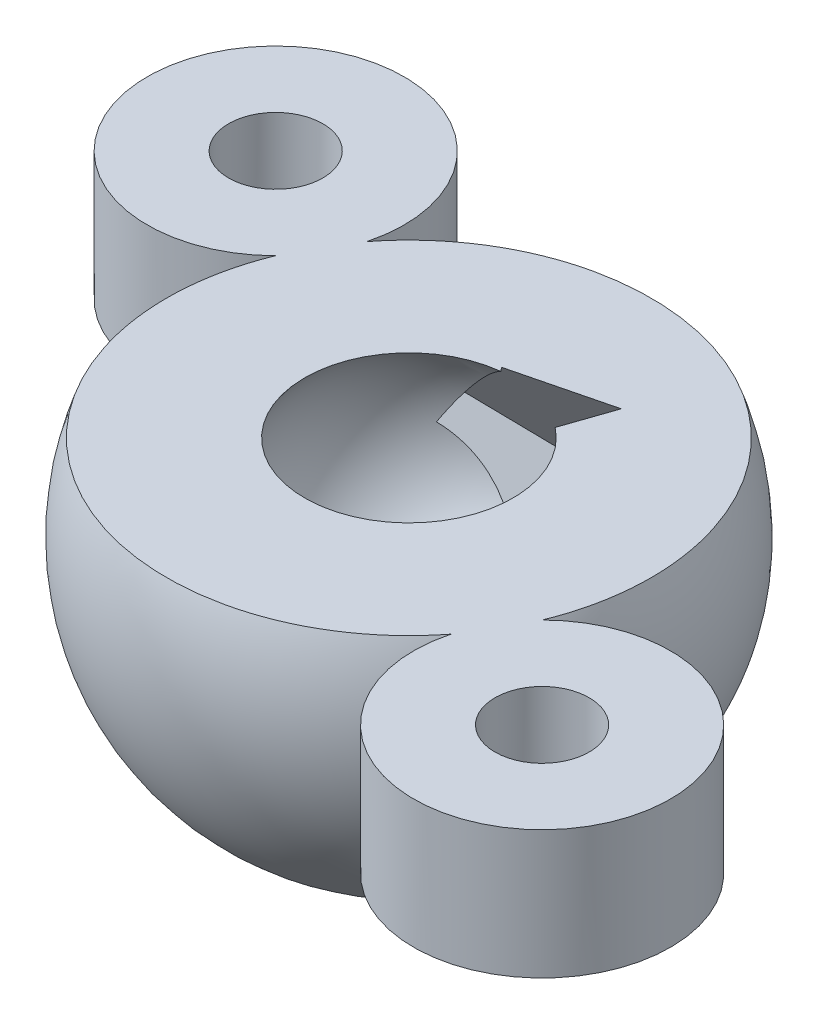
from build123d import *

# Parameters (mm, degrees)
DOME_TRIM_SKETCH_W           = 13.999999999999993
DOME_TRIM_SKETCH_H           = 5.000000000000014
DOME_TRIM_DEPTH              = 14
RETAINER_FEATURE_3_PROFILE_R = 3.0000000000000027
RETAINER_FEATURE_3_DEPTH     = 3
RETAINER_FEATURE_4_PROFILE_R = 3.0000000000000027
RETAINER_FEATURE_4_DEPTH     = 3
RETAINER_FEATURE_6_PROFILE_R = 1.1000000000000036
RETAINER_FEATURE_6_DEPTH     = 4.25
RETAINER_FEATURE_7_PROFILE_R = 2.1000000000000045
RETAINER_FEATURE_7_DEPTH     = 1.45
RETAINER_FEATURE_8_PROFILE_R = 1.1000000000000036
RETAINER_FEATURE_8_DEPTH     = 4.25
RETAINER_FEATURE_9_PROFILE_R = 2.1000000000000045
RETAINER_FEATURE_9_DEPTH     = 1.45
RETAINER_FEATURE_12_DEPTH    = 10


with BuildPart() as part:
    # Retainer Dome Sketch → Retainer Dome (revolve)
    with BuildSketch(Plane(origin=(0, -73, 0), x_dir=(-1, 0, 0), z_dir=(0, -1, 0))):
        with BuildLine():
            Line((76.48780366869515, -22.98076211353316), (66.09549882328189, -28.980762113533164))
            ThreePointArc((66.09549882328189, -28.980762113533164), (74.29165124598852, -31.176914536239792), (76.48780366869515, -22.98076211353316))
        make_face()
    revolve(axis=Axis((-62.63139720814413, -73, 30.98076211353316), (-0.8660254037844387, 0, -0.49999999999999994)))

    # Dome Trim Sketch → Dome Trim (cut)
    with BuildSketch(Plane(origin=(-36.156560608000376, 0, -20.874999999999996), x_dir=(-0.49999999999999944, 0, 0.866025403784439), z_dir=(-0.866025403784439, 0, -0.49999999999999944))):
        with Locations((58.145825622994224, -68.5)):
            Rectangle(DOME_TRIM_SKETCH_W, DOME_TRIM_SKETCH_H)
    extrude(amount=DOME_TRIM_DEPTH, mode=Mode.SUBTRACT)

    # Retainer Feature 3 profile → Retainer Feature 3 (add)
    with BuildSketch(Plane(origin=(0, -71.00000000000001, 0), x_dir=(-1, 0, 0), z_dir=(0, -1, 0))):
        with Locations((63.93043531382078, -30.23076211353316)):
            Circle(RETAINER_FEATURE_3_PROFILE_R)
    extrude(amount=RETAINER_FEATURE_3_DEPTH)

    # Retainer Feature 4 profile → Retainer Feature 4 (add)
    with BuildSketch(Plane(origin=(0, -71.00000000000001, 0), x_dir=(-1, 0, 0), z_dir=(0, -1, 0))):
        with Locations((78.65286717815624, -21.73076211353316)):
            Circle(RETAINER_FEATURE_4_PROFILE_R)
    extrude(amount=RETAINER_FEATURE_4_DEPTH)

    # Spherical Seat Sketch → Spherical Seat (revolve, cut)
    with BuildSketch(Plane(origin=(0, -73, 0), x_dir=(-1, 0, 0), z_dir=(0, -1, 0))):
        with BuildLine():
            Line((74.0196312679095, -24.405762113533164), (68.56367122406753, -27.55576211353316))
            ThreePointArc((68.56367122406753, -27.55576211353316), (72.86665124598852, -28.708742135454145), (74.0196312679095, -24.405762113533164))
        make_face()
    revolve(axis=Axis((-62.63139720814413, -73, 30.98076211353316), (-0.8660254037844387, 0, -0.49999999999999994)), mode=Mode.SUBTRACT)

    # Retainer Feature 6 profile → Retainer Feature 6 (cut)
    with BuildSketch(Plane(origin=(0, -70, 0), x_dir=(-1, 0, 0), z_dir=(0, -1, 0))):
        with Locations(Location((63.93043531382078, -30.23076211353316, 0), (0, 0, 270))):
            Circle(RETAINER_FEATURE_6_PROFILE_R)
    extrude(amount=RETAINER_FEATURE_6_DEPTH, mode=Mode.SUBTRACT)

    # Retainer Feature 7 profile → Retainer Feature 7 (cut)
    with BuildSketch(Plane(origin=(0, -72.8, 0), x_dir=(-1, 0, 0), z_dir=(0, -1, 0))):
        with Locations(Location((63.93043531382078, -30.23076211353316, 0), (0, 0, 90))):
            Circle(RETAINER_FEATURE_7_PROFILE_R)
    extrude(amount=RETAINER_FEATURE_7_DEPTH, mode=Mode.SUBTRACT)

    # Retainer Feature 8 profile → Retainer Feature 8 (cut)
    with BuildSketch(Plane(origin=(0, -70, 0), x_dir=(-1, 0, 0), z_dir=(0, -1, 0))):
        with Locations(Location((78.65286717815624, -21.73076211353316, 0), (0, 0, 270))):
            Circle(RETAINER_FEATURE_8_PROFILE_R)
    extrude(amount=RETAINER_FEATURE_8_DEPTH, mode=Mode.SUBTRACT)

    # Retainer Feature 9 profile → Retainer Feature 9 (cut)
    with BuildSketch(Plane(origin=(0, -72.8, 0), x_dir=(-1, 0, 0), z_dir=(0, -1, 0))):
        with Locations(Location((78.65286717815624, -21.73076211353316, 0), (0, 0, 90))):
            Circle(RETAINER_FEATURE_9_PROFILE_R)
    extrude(amount=RETAINER_FEATURE_9_DEPTH, mode=Mode.SUBTRACT)

    # Middle Right Fixed Compression Ball Reta → Retainer Feature 12 (cut)
    with BuildSketch(Plane(origin=(-14.254693004611807, 11.570307263062046, 11.176575862570408), x_dir=(-0.403732922701292, 0.3277035826977628, -0.854172165909264), z_dir=(0.6631997284167644, -0.5383086561091629, -0.5199902989343905))):
        Polygon((-14.819319931758496, -98.86212155097724), (-20.944840012243684, -100.71630701731351), (-19.843917391606514, -104.3533345651016), (-13.718397311121315, -102.49914909876533), align=None)
    extrude(amount=RETAINER_FEATURE_12_DEPTH, mode=Mode.SUBTRACT)


solid = part.part
